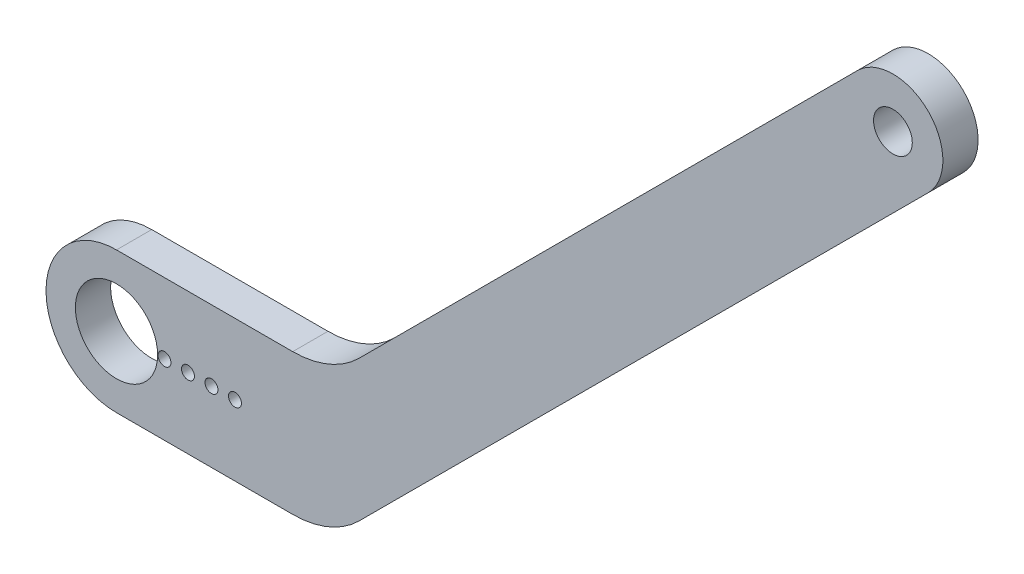
from build123d import *

# Parameters (mm, degrees)
EXTRUDE_1_DEPTH      = 3
SKETCH_9_R           = 3.5
SKETCH_9_R_2         = 1.65
CUT_EXTRUDE_5_DEPTH  = 6
CUT_EXTRUDE_START    = -1
CUT_EXTRUDE_7_DEPTH  = 87.53280603
SKETCH_13_R          = 0.55
CUT_EXTRUDE_10_DEPTH = 88.53280603


with BuildPart() as part:
    # 草图1 → 凸台-拉伸1 (new body)
    with BuildSketch(Plane.XY):
        with BuildLine():
            Line((14.999750012, 5.999750001), (0.000249999, 5.999750001))
            ThreePointArc((0.000249999, 5.999750001), (-5.999750001, -0.000249999), (0.000249999, -6.000249999))
            Line((0.000249999, -6.000249999), (14.991867742, -6.000249999))
            ThreePointArc((14.991867742, -6.000249999), (18.052240297, -5.391739688), (20.647045788, -3.658779955))
            Line((20.647045788, -3.658779955), (69.093668761, 44.759144982))
            ThreePointArc((69.093668761, 44.759144982), (69.093668761, 50.769552622), (63.083261121, 50.769552622))
            Line((63.083261121, 50.769552622), (20.656854249, 8.343145751))
            ThreePointArc((20.656854249, 8.343145751), (18.061380786, 6.60878139), (14.999750012, 5.999750001))
        make_face()
    extrude(amount=EXTRUDE_1_DEPTH)

    # 草图9 → 切除-拉伸5 (cut)
    with BuildSketch(Plane.XY.offset(3)):
        Circle(SKETCH_9_R)
        with Locations((66.088464941, 47.764348802)):
            Circle(SKETCH_9_R_2)
    extrude(amount=-CUT_EXTRUDE_5_DEPTH, mode=Mode.SUBTRACT)

    # 草图9<4> → 切除-拉伸7 (cut, through all)
    with BuildSketch(Plane.XY.offset(3).offset(CUT_EXTRUDE_START)):
        with BuildLine():
            Line((14.2, 1.55872543), (2.168203804, 2.747524752))
            ThreePointArc((2.168203804, 2.747524752), (3.149501017, 1.526644472), (3.5, 0))
            ThreePointArc((3.5, 0), (3.149501017, -1.526644472), (2.168203804, -2.747524752))
            Line((2.168203804, -2.747524752), (14.2, -1.94127457))
            ThreePointArc((14.2, -1.94127457), (15.785612929, -0.19127457), (14.2, 1.55872543))
        make_face()
    extrude(amount=-CUT_EXTRUDE_7_DEPTH, mode=Mode.SUBTRACT)

    # 草图13 → 切除-拉伸10 (cut, through all)
    with BuildSketch(Plane.XY.offset(3)):
        with Locations((4.085, 0)):
            Circle(SKETCH_13_R)
        with Locations((6.085, 0)):
            Circle(SKETCH_13_R)
        with Locations((8.085, 0)):
            Circle(SKETCH_13_R)
        with Locations((10.085, 0)):
            Circle(SKETCH_13_R)
    extrude(amount=-CUT_EXTRUDE_10_DEPTH, mode=Mode.SUBTRACT)


solid = part.part
